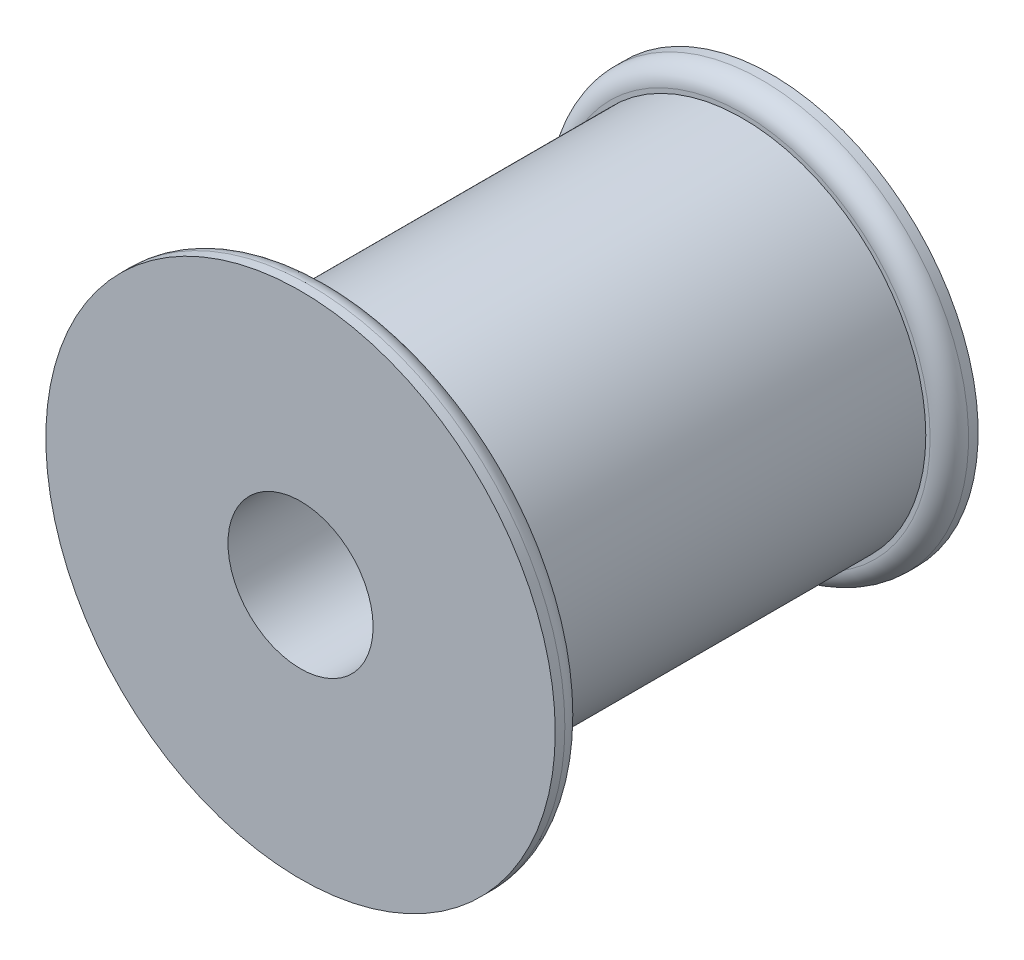
from build123d import *

# Parameters (mm, degrees)
SKETCH1_R           = 19.05
SKETCH1_R_2         = 4.14
BOSS_EXTRUDE1_DEPTH = 43
SKETCH2_R           = 26.5
BOSS_EXTRUDE2_DEPTH = 3
BOSS_EXTRUDE3_START = 3
SKETCH3_R           = 21.5
SKETCH3_R_2         = 4.14
BOSS_EXTRUDE3_DEPTH = 3
SKETCH4_R           = 7.55
CUT_EXTRUDE1_DEPTH  = 15
FILLET1_R           = 2
FILLET2_R           = 2


with BuildPart() as part:
    # Sketch1 → Boss-Extrude1 (new body)
    with BuildSketch(Plane.XY):
        Circle(SKETCH1_R)
        Circle(SKETCH1_R_2, mode=Mode.SUBTRACT)
    extrude(amount=BOSS_EXTRUDE1_DEPTH)

    # Sketch2 → Boss-Extrude2 (add)
    with BuildSketch(Plane.XY.offset(43)):
        Circle(SKETCH2_R)
    extrude(amount=BOSS_EXTRUDE2_DEPTH)

    # Sketch3 → Boss-Extrude3 (add)
    with BuildSketch(Plane(origin=(0, 0, 0), x_dir=(-1, 0, 0), z_dir=(0, 0, -1)).offset(BOSS_EXTRUDE3_START)):
        Circle(SKETCH3_R)
        Circle(SKETCH3_R_2, mode=Mode.SUBTRACT)
    extrude(amount=-BOSS_EXTRUDE3_DEPTH)

    # Sketch4 → Cut-Extrude1 (cut)
    with BuildSketch(Plane.XY.offset(46)):
        Circle(SKETCH4_R)
    extrude(amount=-CUT_EXTRUDE1_DEPTH, mode=Mode.SUBTRACT)

    # Fillet1
    fillet1_edges = [part.edges().sort_by_distance(p)[0] for p in [
        (-26.5, 0, 43),
    ]]
    fillet(fillet1_edges, radius=FILLET1_R)

    # Fillet2
    fillet2_edges = [part.edges().sort_by_distance(p)[0] for p in [
        (21.5, 0, 0),
    ]]
    fillet(fillet2_edges, radius=FILLET2_R)


solid = part.part
